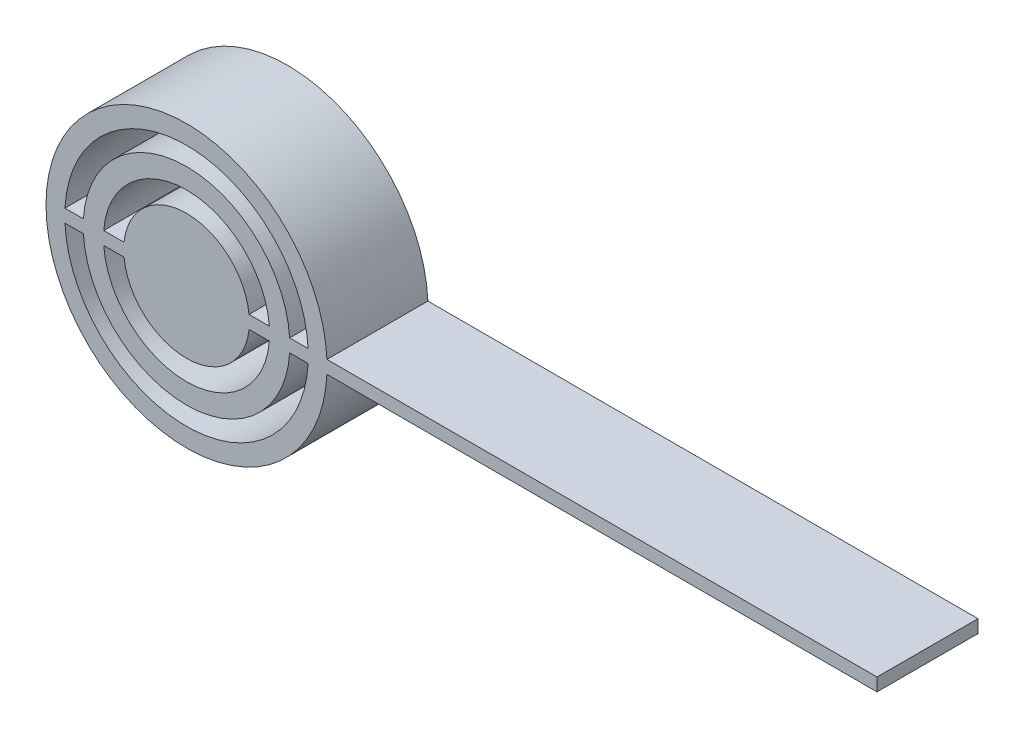
from build123d import *

# Parameters (mm, degrees)
EXTRUDE_4_DEPTH = 40


with BuildPart() as part:
    # 草图2 → 凸台-拉伸4 (new body)
    with BuildSketch(Plane.XY):
        with BuildLine():
            Line((55.601230388, 2.559909891), (273.486476264, 2.559909891))
            Line((273.486476264, 2.559909891), (273.486476264, -2.559909891))
            Line((273.486476264, -2.559909891), (55.601230388, -2.559909891))
            ThreePointArc((55.601230388, -2.559909891), (-55.660128991, 0), (55.601230388, 2.559909891))
        make_face()
        with BuildLine():
            ThreePointArc((32.799591871, 2.559909891), (0, 32.899336856), (-32.799591871, 2.559909891))
            Line((-32.799591871, 2.559909891), (-24.758977016, 2.559909891))
            ThreePointArc((-24.758977016, 2.559909891), (0, 24.890963853), (24.758977016, 2.559909891))
            Line((24.758977016, 2.559909891), (32.799591871, 2.559909891))
        make_face(mode=Mode.SUBTRACT)
        with BuildLine():
            Line((-48.158715074, -2.559909891), (-40.845588283, -2.559909891))
            ThreePointArc((-40.845588283, -2.559909891), (0, -40.925728104), (40.845588283, -2.559909891))
            Line((40.845588283, -2.559909891), (48.158715074, -2.559909891))
            ThreePointArc((48.158715074, -2.559909891), (0, -48.226703974), (-48.158715074, -2.559909891))
        make_face(mode=Mode.SUBTRACT)
        with BuildLine():
            Line((40.845588283, 2.559909891), (48.158715074, 2.559909891))
            ThreePointArc((48.158715074, 2.559909891), (0, 48.226703974), (-48.158715074, 2.559909891))
            Line((-48.158715074, 2.559909891), (-40.845588283, 2.559909891))
            ThreePointArc((-40.845588283, 2.559909891), (0, 40.925728104), (40.845588283, 2.559909891))
        make_face(mode=Mode.SUBTRACT)
        with BuildLine():
            Line((-32.799591871, -2.559909891), (-24.758977016, -2.559909891))
            ThreePointArc((-24.758977016, -2.559909891), (0, -24.890963853), (24.758977016, -2.559909891))
            Line((24.758977016, -2.559909891), (32.799591871, -2.559909891))
            ThreePointArc((32.799591871, -2.559909891), (0, -32.899336856), (-32.799591871, -2.559909891))
        make_face(mode=Mode.SUBTRACT)
    extrude(amount=EXTRUDE_4_DEPTH)


solid = part.part
